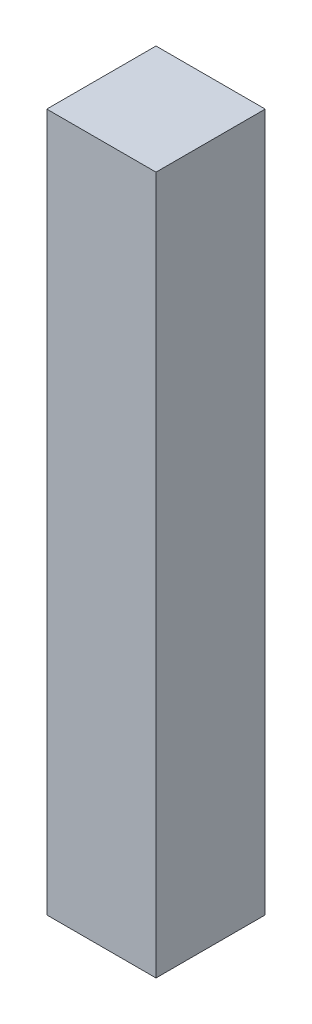
from build123d import *

# Parameters (mm, degrees)
SKETCH1_W           = 18
SKETCH1_H           = 18
BOSS_EXTRUDE1_DEPTH = 115


with BuildPart() as part:
    # Sketch1 → Boss-Extrude1 (new body)
    with BuildSketch(Plane(origin=(0, 0, 0), x_dir=(1, 0, 0), z_dir=(0, 1, 0))):
        with Locations((9, 9)):
            Rectangle(SKETCH1_W, SKETCH1_H)
    extrude(amount=BOSS_EXTRUDE1_DEPTH)


solid = part.part
